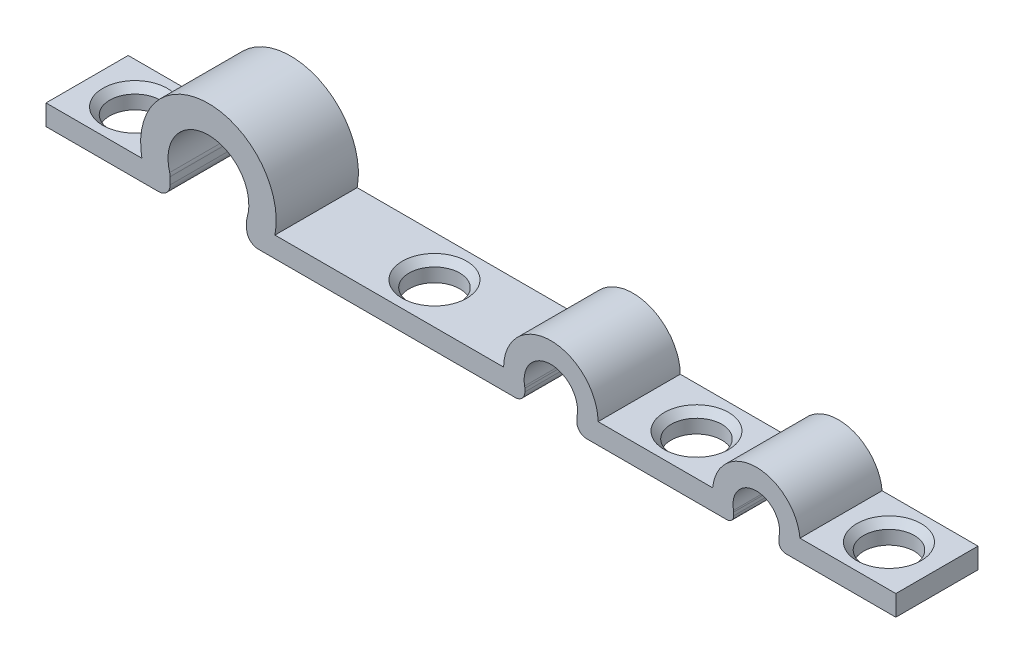
from build123d import *

# Parameters (mm, degrees)
BOSS_EXTRUDE1_DEPTH = 3
CUT_EXTRUDE2_REACH  = 34.033
SKETCH2_R           = 1.85
CHAMFER2_SIZE       = 0.5


with BuildPart() as part:
    # Sketch1 → Boss-Extrude1 (new, symmetric)
    with BuildSketch(Plane.XY):
        with BuildLine():
            Line((-31.021944793, 0), (-22.806809681, 0))
            ThreePointArc((-22.806809681, 0), (-22.205768917, 0.248959236), (-21.956809681, 0.85))
            Line((-21.956809681, 0.85), (-21.956809681, 1.36849254))
            ThreePointArc((-21.956809681, 1.36849254), (-21.965643691, 1.490720925), (-21.9919621, 1.610408683))
            ThreePointArc((-21.9919621, 1.610408683), (-19.163961672, 5.4), (-16.335961244, 1.610408683))
            ThreePointArc((-16.335961244, 1.610408683), (-16.362279653, 1.490720925), (-16.371113663, 1.36849254))
            Line((-16.371113663, 1.36849254), (-16.371113663, 0.85))
            ThreePointArc((-16.371113663, 0.85), (-16.122154427, 0.248959236), (-15.521113663, 0))
            Line((-15.521113663, 0), (3.236038328, 0))
            ThreePointArc((3.236038328, 0), (3.731013075, 0.205025253), (3.936038328, 0.7))
            Line((3.936038328, 0.7), (3.936038328, 0.937652462))
            ThreePointArc((3.936038328, 0.937652462), (3.932728617, 1.005642472), (3.922830781, 1.072989547))
            ThreePointArc((3.922830781, 1.072989547), (5.836038328, 3.4), (7.749245875, 1.072989547))
            ThreePointArc((7.749245875, 1.072989547), (7.739348039, 1.005642472), (7.736038328, 0.937652462))
            Line((7.736038328, 0.937652462), (7.736038328, 0.7))
            ThreePointArc((7.736038328, 0.7), (7.941063581, 0.205025253), (8.436038328, 0))
            Line((8.436038328, 0), (18.686038328, 0))
            ThreePointArc((18.686038328, 0), (19.039591719, 0.146446609), (19.186038328, 0.5))
            Line((19.186038328, 0.5), (19.186038328, 0.733631047))
            ThreePointArc((19.186038328, 0.733631047), (19.183189302, 0.786931226), (19.174674692, 0.839623991))
            ThreePointArc((19.174674692, 0.839623991), (20.836038328, 2.9), (22.497401964, 0.839623991))
            ThreePointArc((22.497401964, 0.839623991), (22.488887354, 0.786931226), (22.486038328, 0.733631047))
            Line((22.486038328, 0.733631047), (22.486038328, 0.5))
            ThreePointArc((22.486038328, 0.5), (22.632484937, 0.146446609), (22.986038328, 0))
            Line((22.986038328, 0), (31.021944793, 0))
            Line((31.021944793, 0), (31.021944793, 1.5))
            Line((31.021944793, 1.5), (24.021944793, 1.5))
            ThreePointArc((24.021944793, 1.5), (20.836038328, 4.4), (17.650131864, 1.5))
            Line((17.650131864, 1.5), (9.28567599, 1.5))
            ThreePointArc((9.28567599, 1.5), (5.836038328, 4.9), (2.386400666, 1.5))
            Line((2.386400666, 1.5), (-14.305978551, 1.5))
            ThreePointArc((-14.305978551, 1.5), (-19.163961672, 7.4), (-24.021944793, 1.5))
            Line((-24.021944793, 1.5), (-31.021944793, 1.5))
            Line((-31.021944793, 1.5), (-31.021944793, 0))
        make_face()
    extrude(amount=BOSS_EXTRUDE1_DEPTH, both=True)

    # Sketch2 → Cut-Extrude2 (cut, up to next)
    with BuildSketch(Plane(origin=(0, 0, 0), x_dir=(1, 0, 0), z_dir=(0, 1, 0)), mode=Mode.PRIVATE) as cut_extrude2_sk1:
        with Locations((-27.521944793, 0)):
            Circle(SKETCH2_R)
    cut_extrude2_tool1 = extrude(cut_extrude2_sk1.sketch, amount=CUT_EXTRUDE2_REACH, mode=Mode.PRIVATE) & part.part
    # Sketch2 → Cut-Extrude2 (cut, up to next)
    with BuildSketch(Plane(origin=(0, 0, 0), x_dir=(1, 0, 0), z_dir=(0, 1, 0)), mode=Mode.PRIVATE) as cut_extrude2_sk2:
        with Locations((-5.659788943, 0)):
            Circle(SKETCH2_R)
    cut_extrude2_tool2 = extrude(cut_extrude2_sk2.sketch, amount=CUT_EXTRUDE2_REACH, mode=Mode.PRIVATE) & part.part
    # Sketch2 → Cut-Extrude2 (cut, up to next)
    with BuildSketch(Plane(origin=(0, 0, 0), x_dir=(1, 0, 0), z_dir=(0, 1, 0)), mode=Mode.PRIVATE) as cut_extrude2_sk3:
        with Locations((27.521944793, 0)):
            Circle(SKETCH2_R)
    cut_extrude2_tool3 = extrude(cut_extrude2_sk3.sketch, amount=CUT_EXTRUDE2_REACH, mode=Mode.PRIVATE) & part.part
    # Sketch2 → Cut-Extrude2 (cut, up to next)
    with BuildSketch(Plane(origin=(0, 0, 0), x_dir=(1, 0, 0), z_dir=(0, 1, 0)), mode=Mode.PRIVATE) as cut_extrude2_sk4:
        with Locations((13.467903927, 0)):
            Circle(SKETCH2_R)
    cut_extrude2_tool4 = extrude(cut_extrude2_sk4.sketch, amount=CUT_EXTRUDE2_REACH, mode=Mode.PRIVATE) & part.part
    add(cut_extrude2_tool1.solids().sort_by_distance((-27.521945, 0, 0))[0], mode=Mode.SUBTRACT)
    add(cut_extrude2_tool2.solids().sort_by_distance((-5.659789, 0, 0))[0], mode=Mode.SUBTRACT)
    add(cut_extrude2_tool3.solids().sort_by_distance((27.521945, 0, 0))[0], mode=Mode.SUBTRACT)
    add(cut_extrude2_tool4.solids().sort_by_distance((13.467904, 0, 0))[0], mode=Mode.SUBTRACT)

    # Chamfer2
    chamfer2_edges = [part.edges().sort_by_distance(p)[0] for p in [
        (25.671944793, 1.5, 0),
        (11.617903927, 1.5, 0),
        (-7.509788943, 1.5, 0),
        (-29.371944793, 1.5, 0),
    ]]
    chamfer(chamfer2_edges, length=CHAMFER2_SIZE)


solid = part.part
